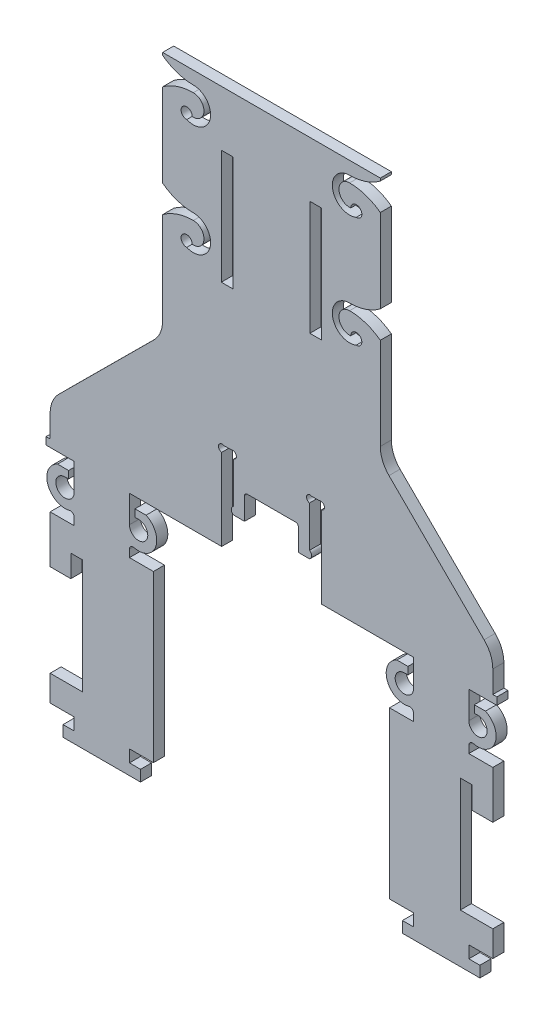
from build123d import *

# Parameters (mm, degrees)
MAIN_SPAR_DEPTH                                = 3
T_TABS_TOP_PLATE_DEPTH                         = 3
LONG_TAB_DEPTH                                 = 3
SKETCH2_W                                      = 3.2
SKETCH2_H                                      = 31
TAB_SLOTS_DEPTH                                = 182.612802412
TAB_SLOT_EXTRA_RELIEF_AND_CABLE_CLEARANC_REACH = 183.613
SKETCH9_W                                      = 13.1
SKETCH9_H                                      = 15.75
SIDE_PLATE_SLOT_DEPTH                          = 182.612802412
ELASTIC_ANCHORS_REACH                          = 183.613


with BuildPart() as part:
    # Sketch1 → main spar (new body)
    with BuildSketch(Plane.XY):
        with BuildLine():
            Line((-29.5, 171), (29.5, 171))
            Line((29.5, 171), (29.5, 108))
            ThreePointArc((29.5, 108), (30.112758667, 104.92938679), (31.857166371, 102.329159794))
            Line((31.857166371, 102.329159794), (57.642833629, 76.670840206))
            ThreePointArc((57.642833629, 76.670840206), (59.387241333, 74.07061321), (60, 71))
            Line((60, 71), (60, 63))
            Line((60, 63), (0, 63))
            Line((0, 63), (-60, 63))
            Line((-60, 63), (-60, 71))
            ThreePointArc((-60, 71), (-59.387241333, 74.07061321), (-57.642833629, 76.670840206))
            Line((-57.642833629, 76.670840206), (-31.857166371, 102.329159794))
            ThreePointArc((-31.857166371, 102.329159794), (-30.112758667, 104.92938679), (-29.5, 108))
            Line((-29.5, 108), (-29.5, 171))
        make_face()
    extrude(amount=MAIN_SPAR_DEPTH)

    # Sketch10 → T tabs top plate (add)
    with BuildSketch(Plane(origin=(0, 0, 0), x_dir=(-1, 0, 0), z_dir=(0, 0, -1))):
        with BuildLine():
            Line((53.5, 63), (53.5, 55.616234023))
            ThreePointArc((53.5, 55.616234023), (57.740053742, 53.859946258), (55.983765977, 58.1))
            Line((55.983765977, 58.1), (55, 58.1))
            Line((55, 58.1), (55, 60.1))
            Line((55, 60.1), (58, 60.1))
            ThreePointArc((58, 60.1), (60.621768891, 53.985808943), (54.750795687, 50.857122632))
            ThreePointArc((54.750795687, 50.857122632), (53.887952488, 50.679903583), (53.5, 49.88908259))
            Line((53.5, 49.88908259), (53.5, 47.88908259))
            Line((53.5, 47.88908259), (38.5, 47.88908259))
            Line((38.5, 47.88908259), (38.5, 49.88908259))
            ThreePointArc((38.5, 49.88908259), (38.112047512, 50.679903583), (37.249204313, 50.857122632))
            ThreePointArc((37.249204313, 50.857122632), (31.378231109, 53.985808943), (34, 60.1))
            Line((34, 60.1), (37, 60.1))
            Line((37, 60.1), (37, 58.1))
            Line((37, 58.1), (36.016234023, 58.1))
            ThreePointArc((36.016234023, 58.1), (34.259946258, 53.859946258), (38.5, 55.616234023))
            Line((38.5, 55.616234023), (38.5, 63))
            Line((38.5, 63), (30.9, 63))
            Line((30.9, 63), (30.9, 65))
            Line((30.9, 65), (61.1, 65))
            Line((61.1, 65), (61.1, 63))
            Line((61.1, 63), (53.5, 63))
        make_face()
        with BuildLine():
            Line((-38.5, 63), (-38.5, 55.616234023))
            ThreePointArc((-38.5, 55.616234023), (-34.259946258, 53.859946258), (-36.016234023, 58.1))
            Line((-36.016234023, 58.1), (-37, 58.1))
            Line((-37, 58.1), (-37, 60.1))
            Line((-37, 60.1), (-34, 60.1))
            ThreePointArc((-34, 60.1), (-31.378231109, 53.985808943), (-37.249204313, 50.857122632))
            ThreePointArc((-37.249204313, 50.857122632), (-38.112047512, 50.679903583), (-38.5, 49.88908259))
            Line((-38.5, 49.88908259), (-38.5, 47.88908259))
            Line((-38.5, 47.88908259), (-53.5, 47.88908259))
            Line((-53.5, 47.88908259), (-53.5, 49.88908259))
            ThreePointArc((-53.5, 49.88908259), (-53.887952488, 50.679903583), (-54.750795687, 50.857122632))
            ThreePointArc((-54.750795687, 50.857122632), (-60.621768891, 53.985808943), (-58, 60.1))
            Line((-58, 60.1), (-55, 60.1))
            Line((-55, 60.1), (-55, 58.1))
            Line((-55, 58.1), (-55.983765977, 58.1))
            ThreePointArc((-55.983765977, 58.1), (-57.740053742, 53.859946258), (-53.5, 55.616234023))
            Line((-53.5, 55.616234023), (-53.5, 63))
            Line((-53.5, 63), (-61.1, 63))
            Line((-61.1, 63), (-61.1, 65))
            Line((-61.1, 65), (-30.9, 65))
            Line((-30.9, 65), (-30.9, 63))
            Line((-30.9, 63), (-38.5, 63))
        make_face()
    extrude(amount=-T_TABS_TOP_PLATE_DEPTH)

    # Sketch11 → long tab (add)
    with BuildSketch(Plane(origin=(0, 0, 0), x_dir=(-1, 0, 0), z_dir=(0, 0, -1))):
        Polygon((32, 47.88908259), (60, 47.88908259), (60, 3), (53.5, 3), (53.5, -0.3), (56.5, -0.3), (56.5, -3.3), (35.5, -3.3), (35.5, -0.3), (38.5, -0.3), (38.5, 3), (32, 3), align=None)
        Polygon((-60, 47.88908259), (-32, 47.88908259), (-32, 3), (-38.5, 3), (-38.5, -0.3), (-35.5, -0.3), (-35.5, -3.3), (-56.5, -3.3), (-56.5, -0.3), (-53.5, -0.3), (-53.5, 3), (-60, 3), align=None)
    extrude(amount=-LONG_TAB_DEPTH)

    # Sketch2 → tab slots (cut, through all)
    with BuildSketch(Plane.XY.offset(3)):
        with Locations((12, 140.5)):
            Rectangle(SKETCH2_W, SKETCH2_H)
        with Locations((-12, 140.5)):
            Rectangle(SKETCH2_W, SKETCH2_H)
        with BuildLine():
            Line((10.3, 72), (7.3, 72))
            Line((7.3, 72), (7.3, 78))
            ThreePointArc((7.3, 78), (6.55, 78.75), (5.8, 78))
            Line((5.8, 78), (5.8, 57))
            Line((5.8, 57), (13.5, 57))
            Line((13.5, 57), (13.5, 72))
            Line((13.5, 72), (13.5, 85.108254278))
            ThreePointArc((13.5, 85.108254278), (14.330080695, 86.38576104), (12.935889894, 87))
            Line((12.935889894, 87), (10.935889894, 87))
            ThreePointArc((10.935889894, 87), (9.55273068, 86.420438505), (10.3, 85.120204103))
            Line((10.3, 85.120204103), (10.3, 74))
            ThreePointArc((10.3, 74), (10.9, 73), (10.3, 72))
        make_face()
        with BuildLine():
            Line((-10.3, 72), (-7.3, 72))
            Line((-7.3, 72), (-7.3, 78))
            ThreePointArc((-7.3, 78), (-6.55, 78.75), (-5.8, 78))
            Line((-5.8, 78), (-5.8, 57))
            Line((-5.8, 57), (-13.5, 57))
            Line((-13.5, 57), (-13.5, 72))
            Line((-13.5, 72), (-13.5, 85.108254278))
            ThreePointArc((-13.5, 85.108254278), (-14.330080695, 86.38576104), (-12.935889894, 87))
            Line((-12.935889894, 87), (-10.935889894, 87))
            ThreePointArc((-10.935889894, 87), (-9.55273068, 86.420438505), (-10.3, 85.120204103))
            Line((-10.3, 85.120204103), (-10.3, 74))
            ThreePointArc((-10.3, 74), (-10.9, 73), (-10.3, 72))
        make_face()
    extrude(amount=-TAB_SLOTS_DEPTH, mode=Mode.SUBTRACT)

    # Sketch9 → tab slot extra relief and cable clearanc (cut, up to next)
    with BuildSketch(Plane.XY.offset(3), mode=Mode.PRIVATE) as tab_slot_extra_relief_and_cable_clearanc_sk1:
        with Locations((0, 70.875)):
            Rectangle(SKETCH9_W, SKETCH9_H)
    tab_slot_extra_relief_and_cable_clearanc_tool1 = extrude(tab_slot_extra_relief_and_cable_clearanc_sk1.sketch, amount=-TAB_SLOT_EXTRA_RELIEF_AND_CABLE_CLEARANC_REACH, mode=Mode.PRIVATE) & part.part
    add(tab_slot_extra_relief_and_cable_clearanc_tool1.solids().sort_by_distance((0, 70.875, 3))[0], mode=Mode.SUBTRACT)

    # Sketch4 → side plate slot (cut, through all)
    with BuildSketch(Plane.XY.offset(3)):
        Polygon((-60, 35), (-54.39, 35), (-54.39, 41), (-51.19, 41), (-51.19, 10), (-60, 10), align=None)
    side_plate_slot = extrude(amount=-SIDE_PLATE_SLOT_DEPTH, mode=Mode.SUBTRACT)

    # side plate slot mirror: side plate slot across plane
    add(side_plate_slot.mirror(Plane(origin=(0, 0, 0), x_dir=(0, 0, 1), z_dir=(1, 0, 0))), mode=Mode.SUBTRACT)

    # Sketch8 → elastic anchors (cut, up to next)
    with BuildSketch(Plane.XY.offset(3), mode=Mode.PRIVATE) as elastic_anchors_sk1:
        with BuildLine():
            ThreePointArc((22.96414143, 158.500428674), (24.060660172, 161.060660172), (21.500428674, 159.96414143))
            ThreePointArc((21.500428674, 159.96414143), (18.304532331, 162.662597854), (21.178026712, 165.702079807))
            ThreePointArc((21.178026712, 165.702079807), (24.986612172, 165.166705802), (28.5, 163.602079807))
            ThreePointArc((28.5, 163.602079807), (32.25852471, 160.13767164), (34.5, 155.543716867))
            Line((34.5, 155.543716867), (34.5, 177.660442747))
            ThreePointArc((34.5, 177.660442747), (32.25852471, 173.066487973), (28.5, 169.602079807))
            ThreePointArc((28.5, 169.602079807), (24.986612172, 168.037453812), (21.178026712, 167.502079807))
            ThreePointArc((21.178026712, 167.502079807), (16.589455886, 161.913585252), (22.96414143, 158.500428674))
        make_face()
    elastic_anchors_tool1 = extrude(elastic_anchors_sk1.sketch, amount=-ELASTIC_ANCHORS_REACH, mode=Mode.PRIVATE) & part.part
    # Sketch8 → elastic anchors (cut, up to next)
    with BuildSketch(Plane.XY.offset(3), mode=Mode.PRIVATE) as elastic_anchors_sk2:
        with BuildLine():
            ThreePointArc((22.96414143, 128.500428674), (24.060660172, 131.060660172), (21.500428674, 129.96414143))
            ThreePointArc((21.500428674, 129.96414143), (18.304532331, 132.662597854), (21.178026712, 135.702079807))
            ThreePointArc((21.178026712, 135.702079807), (24.986612172, 135.166705802), (28.5, 133.602079807))
            ThreePointArc((28.5, 133.602079807), (32.25852471, 130.13767164), (34.5, 125.543716867))
            Line((34.5, 125.543716867), (34.5, 147.660442747))
            ThreePointArc((34.5, 147.660442747), (32.25852471, 143.066487973), (28.5, 139.602079807))
            ThreePointArc((28.5, 139.602079807), (24.986612172, 138.037453812), (21.178026712, 137.502079807))
            ThreePointArc((21.178026712, 137.502079807), (16.589455886, 131.913585252), (22.96414143, 128.500428674))
        make_face()
    elastic_anchors_tool2 = extrude(elastic_anchors_sk2.sketch, amount=-ELASTIC_ANCHORS_REACH, mode=Mode.PRIVATE) & part.part
    # Sketch8 → elastic anchors (cut, up to next)
    with BuildSketch(Plane.XY.offset(3), mode=Mode.PRIVATE) as elastic_anchors_sk3:
        with BuildLine():
            ThreePointArc((-22.96414143, 128.500428674), (-24.060660172, 131.060660172), (-21.500428674, 129.96414143))
            ThreePointArc((-21.500428674, 129.96414143), (-18.304532331, 132.662597854), (-21.178026712, 135.702079807))
            ThreePointArc((-21.178026712, 135.702079807), (-24.986612172, 135.166705802), (-28.5, 133.602079807))
            ThreePointArc((-28.5, 133.602079807), (-32.25852471, 130.13767164), (-34.5, 125.543716867))
            Line((-34.5, 125.543716867), (-34.5, 147.660442747))
            ThreePointArc((-34.5, 147.660442747), (-32.25852471, 143.066487973), (-28.5, 139.602079807))
            ThreePointArc((-28.5, 139.602079807), (-24.986612172, 138.037453812), (-21.178026712, 137.502079807))
            ThreePointArc((-21.178026712, 137.502079807), (-16.589455886, 131.913585252), (-22.96414143, 128.500428674))
        make_face()
    elastic_anchors_tool3 = extrude(elastic_anchors_sk3.sketch, amount=-ELASTIC_ANCHORS_REACH, mode=Mode.PRIVATE) & part.part
    # Sketch8 → elastic anchors (cut, up to next)
    with BuildSketch(Plane.XY.offset(3), mode=Mode.PRIVATE) as elastic_anchors_sk4:
        with BuildLine():
            ThreePointArc((-22.96414143, 158.500428674), (-24.060660172, 161.060660172), (-21.500428674, 159.96414143))
            ThreePointArc((-21.500428674, 159.96414143), (-18.304532331, 162.662597854), (-21.178026712, 165.702079807))
            ThreePointArc((-21.178026712, 165.702079807), (-24.986612172, 165.166705802), (-28.5, 163.602079807))
            ThreePointArc((-28.5, 163.602079807), (-32.25852471, 160.13767164), (-34.5, 155.543716867))
            Line((-34.5, 155.543716867), (-34.5, 177.660442747))
            ThreePointArc((-34.5, 177.660442747), (-32.25852471, 173.066487973), (-28.5, 169.602079807))
            ThreePointArc((-28.5, 169.602079807), (-24.986612172, 168.037453812), (-21.178026712, 167.502079807))
            ThreePointArc((-21.178026712, 167.502079807), (-16.589455886, 161.913585252), (-22.96414143, 158.500428674))
        make_face()
    elastic_anchors_tool4 = extrude(elastic_anchors_sk4.sketch, amount=-ELASTIC_ANCHORS_REACH, mode=Mode.PRIVATE) & part.part
    add(elastic_anchors_tool1.solids().sort_by_distance((27.986566, 165.492974, 3))[0], mode=Mode.SUBTRACT)
    add(elastic_anchors_tool2.solids().sort_by_distance((27.986566, 135.492974, 3))[0], mode=Mode.SUBTRACT)
    add(elastic_anchors_tool3.solids().sort_by_distance((-27.986566, 135.492974, 3))[0], mode=Mode.SUBTRACT)
    add(elastic_anchors_tool4.solids().sort_by_distance((-27.986566, 165.492974, 3))[0], mode=Mode.SUBTRACT)


solid = part.part
